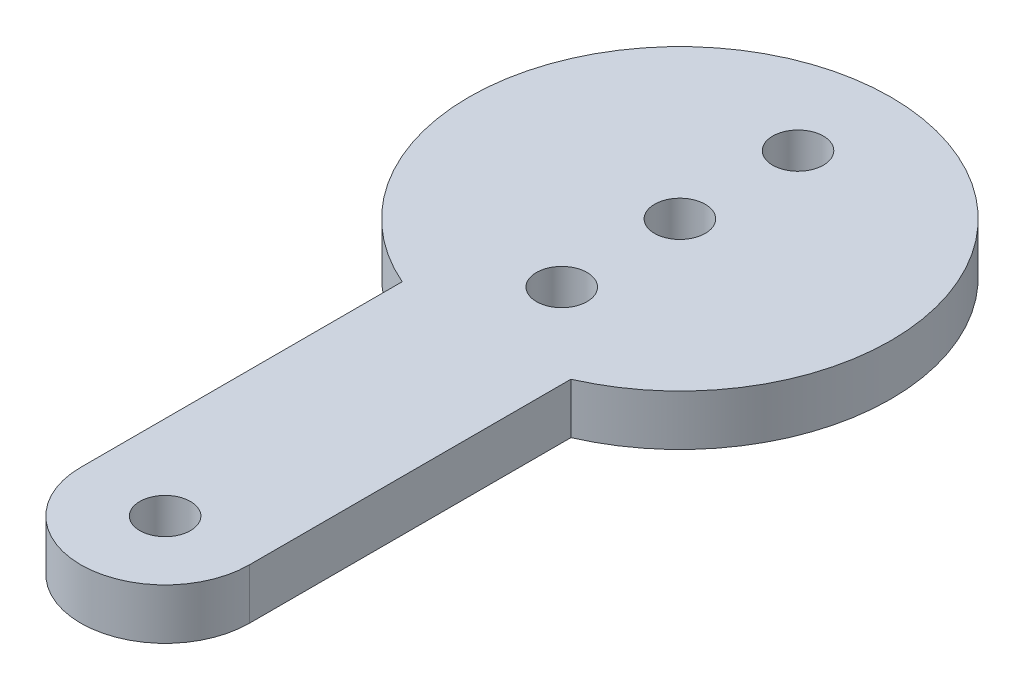
from build123d import *

# Parameters (mm, degrees)
SKETCH1_R           = 1.5
BOSS_EXTRUDE1_DEPTH = 3


with BuildPart() as part:
    # Sketch1 → Boss-Extrude1 (new body)
    with BuildSketch(Plane(origin=(0, 0, 0), x_dir=(1, 0, 0), z_dir=(0, 1, 0))):
        with BuildLine():
            Line((-5, -11.456439237), (-5, -30.5))
            ThreePointArc((-5, -30.5), (0, -35.5), (5, -30.5))
            Line((5, -30.5), (5, -11.456439237))
            ThreePointArc((5, -11.456439237), (0, 12.5), (-5, -11.456439237))
        make_face()
        with Locations(Location((0, 0, 0), (0, 0, 270))):
            Circle(SKETCH1_R, mode=Mode.SUBTRACT)
        with Locations(Location((0, 7, 0), (0, 0, 270))):
            Circle(SKETCH1_R, mode=Mode.SUBTRACT)
        with Locations(Location((0, -7, 0), (0, 0, 270))):
            Circle(SKETCH1_R, mode=Mode.SUBTRACT)
        with Locations(Location((0, -30.5, 0), (0, 0, 270))):
            Circle(SKETCH1_R, mode=Mode.SUBTRACT)
    extrude(amount=BOSS_EXTRUDE1_DEPTH)


solid = part.part
